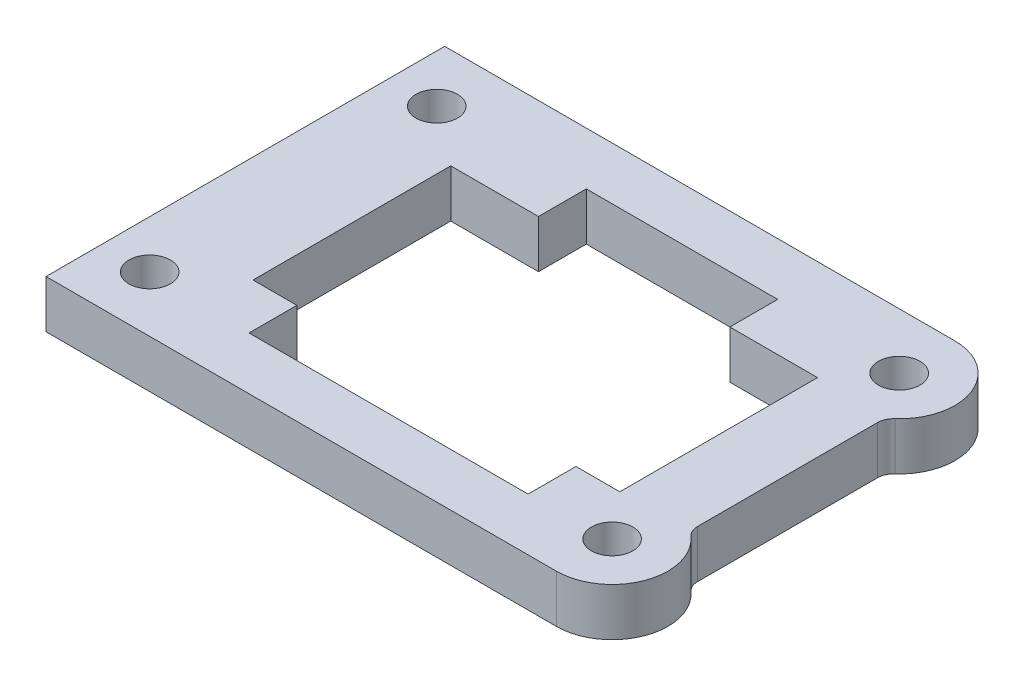
from build123d import *

# Parameters (mm, degrees)
RESSALTO_EXTRUS_O1_DEPTH     = 3
PERFIL_CORTE_W               = 23
PERFIL_CORTE_H               = 12.4
CORTE_PRINCIPAL_DEPTH        = 112.01996056
ESBO_O7_W                    = 12
ESBO_O7_H                    = 3
ESBO_O7_W_2                  = 17.5
CORTE_EXTRUS_O3_DEPTH        = 70.828040064
FURO_DE_DI_METRO_2_6_2_6_1_D = 2.6


with BuildPart() as part:
    # Base Perfil → Ressalto-extrusão1 (new body)
    with BuildSketch(Plane(origin=(0, 0, 0), x_dir=(1, 0, 0), z_dir=(0, 1, 0))):
        with BuildLine():
            Line((-17.5, 12.5), (14.5, 12.5))
            ThreePointArc((14.5, 12.5), (17.769603256, 10.248877314), (16.833333333, 6.391254026))
            ThreePointArc((16.833333333, 6.391254026), (16.587129071, 6.054146324), (16.5, 5.645898034))
            Line((16.5, 5.645898034), (16.5, -5.645898034))
            ThreePointArc((16.5, -5.645898034), (16.587129071, -6.054146324), (16.833333333, -6.391254026))
            ThreePointArc((16.833333333, -6.391254026), (17.769603256, -10.248877314), (14.5, -12.5))
            Line((14.5, -12.5), (-17.5, -12.5))
            Line((-17.5, -12.5), (-17.5, 12.5))
        make_face()
    extrude(amount=RESSALTO_EXTRUS_O1_DEPTH)

    # Perfil Corte → Corte Principal (cut, through all)
    with BuildSketch(Plane(origin=(-89.30915689, 3, 15.805061213), x_dir=(1, 0, 0), z_dir=(0, 1, 0))):
        with Locations((89.98915689, 15.805061213)):
            Rectangle(PERFIL_CORTE_W, PERFIL_CORTE_H)
    extrude(amount=-CORTE_PRINCIPAL_DEPTH, mode=Mode.SUBTRACT)

    # Esboço7 → Corte-extrusão3 (cut, through all)
    with BuildSketch(Plane(origin=(-37.630551407, 3, 29.597469394), x_dir=(1, 0, 0), z_dir=(0, 1, 0))):
        with Locations((38.310551407, 37.297469394)):
            Rectangle(ESBO_O7_W, ESBO_O7_H)
        with Locations((38.310551407, 21.897469394)):
            Rectangle(ESBO_O7_W_2, ESBO_O7_H)
    extrude(amount=-CORTE_EXTRUS_O3_DEPTH, mode=Mode.SUBTRACT)

    # Furo de diâmetro Ø2.6 (2.6)1 (through all)
    with Locations(Plane(origin=(0, 3, 0), x_dir=(1, 0, 0), z_dir=(0, 1, 0))):
        with Locations((-14.5, 9), (-14.5, -9), (14.5, 9), (14.5, -9)):
            Hole(FURO_DE_DI_METRO_2_6_2_6_1_D / 2)


solid = part.part
